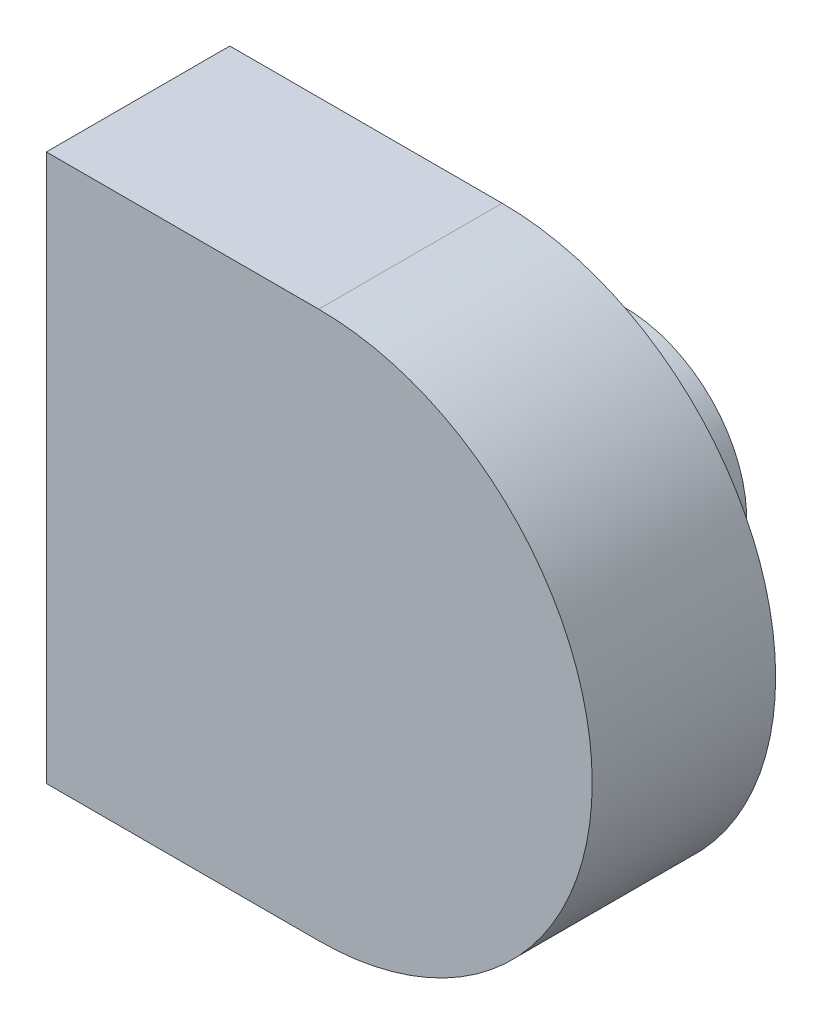
from build123d import *

# Parameters (mm, degrees)
SKETCH_1_W          = 189.06
SKETCH_1_H          = 44.73
EXTRUDE_1_DEPTH     = 15
CUT_EXTRUDE_4_REACH = 196.858
SKETCH_6_R          = 10
EXTRUDE_2_DEPTH     = 10
SKETCH_7_R          = 1
CUT_EXTRUDE_6_DEPTH = 5
SKETCH_8_R          = 12
SKETCH_8_R_2        = 10
EXTRUDE_3_DEPTH     = 2.5


with BuildPart() as part:
    # 草图1 → 凸台-拉伸1 (new body)
    with BuildSketch(Plane.XY):
        with Locations((94.53, 22.365)):
            Rectangle(SKETCH_1_W, SKETCH_1_H)
    extrude(amount=EXTRUDE_1_DEPTH)

    # 草图4 → 切除-拉伸4 (cut, up to next)
    with BuildSketch(Plane.XY.offset(15), mode=Mode.PRIVATE) as cut_extrude_4_sk1:
        with BuildLine():
            Line((22.27, 44.73), (189.06, 44.73))
            Line((189.06, 44.73), (189.06, 0))
            Line((189.06, 0), (22.27, 0))
            ThreePointArc((22.27, 0), (44.635, 22.365), (22.27, 44.73))
        make_face()
    cut_extrude_4_tool1 = extrude(cut_extrude_4_sk1.sketch, amount=-CUT_EXTRUDE_4_REACH, mode=Mode.PRIVATE) & part.part
    add(cut_extrude_4_tool1.solids().sort_by_distance((114.364224, 22.365, 15))[0], mode=Mode.SUBTRACT)

    # 草图6 → 凸台-拉伸2 (add)
    with BuildSketch(Plane(origin=(0, 0, 0), x_dir=(-1, 0, 0), z_dir=(0, 0, -1))):
        with Locations((-22.27, 22.365)):
            Circle(SKETCH_6_R)
    extrude(amount=EXTRUDE_2_DEPTH)

    # 草图7 → 切除-拉伸6 (cut)
    with BuildSketch(Plane(origin=(0, 0, -10), x_dir=(-1, 0, 0), z_dir=(0, 0, -1))):
        with Locations((-22.27, 29.365)):
            Circle(SKETCH_7_R)
        with Locations((-15.27, -108.576623388)):
            Circle(SKETCH_7_R)
        with Locations((-153.211623388, -115.576623388)):
            Circle(SKETCH_7_R)
        with Locations((-160.211623388, 22.365)):
            Circle(SKETCH_7_R)
    extrude(amount=-CUT_EXTRUDE_6_DEPTH, mode=Mode.SUBTRACT)

    # 草图8 → 凸台-拉伸3 (add)
    with BuildSketch(Plane(origin=(0, 0, 0), x_dir=(-1, 0, 0), z_dir=(0, 0, -1))):
        with Locations((-22.27, 22.365)):
            Circle(SKETCH_8_R)
        with Locations((-22.27, 22.365)):
            Circle(SKETCH_8_R_2, mode=Mode.SUBTRACT)
    extrude(amount=EXTRUDE_3_DEPTH)


solid = part.part
